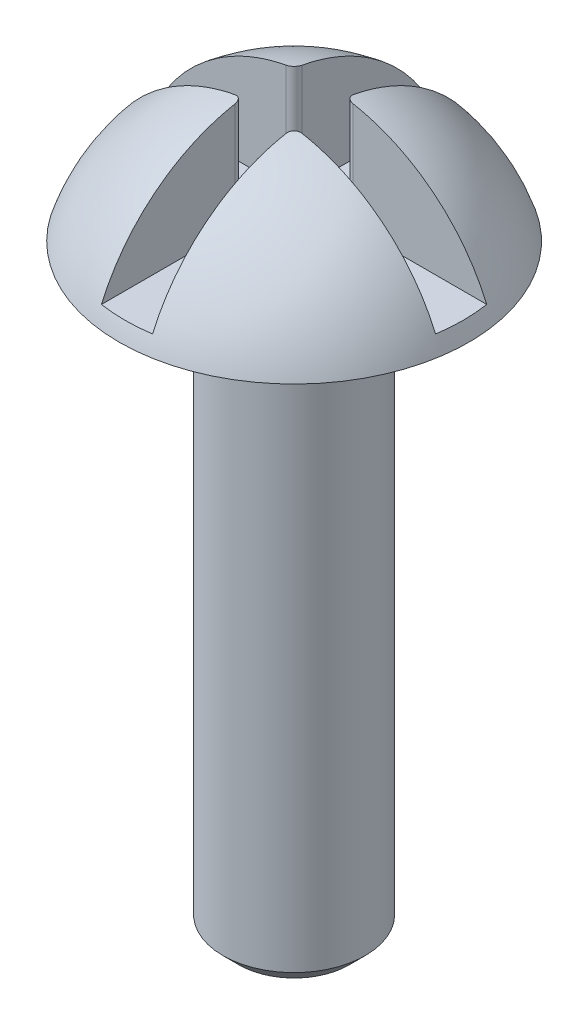
from build123d import *

# Parameters (mm, degrees)
SKETCH3_R           = 1.1303
BOSS_EXTRUDE1_DEPTH = 9.525
CHAMFER1_SIZE       = 0.254
CUT_EXTRUDE1_START  = 0.254
CUT_EXTRUDE1_DEPTH  = 11.051187256
FILLET1_R           = 0.127


with BuildPart() as part:
    # Sketch2 → Revolve1 (revolve)
    with BuildSketch(Plane(origin=(0, 0, 0), x_dir=(0, 0, -1), z_dir=(1, 0, 0))):
        with BuildLine():
            Line((0, 0), (2.7813, 0))
            ThreePointArc((2.7813, 0), (1.72225533, 1.469884796), (0, 2.032))
            Line((0, 2.032), (0, 0))
        make_face()
    revolve(axis=Axis((0, 0.415157056, 0), (0, -1, 0)))

    # Sketch3 → Boss-Extrude1 (add)
    with BuildSketch(Plane.XZ):
        with Locations(Location((0, 0, 0), (0, 0, 90))):
            Circle(SKETCH3_R)
    extrude(amount=BOSS_EXTRUDE1_DEPTH)

    # Chamfer1
    chamfer1_edges = [part.edges().sort_by_distance(p)[0] for p in [
        (0, -9.525, -1.1303),
    ]]
    chamfer(chamfer1_edges, length=CHAMFER1_SIZE)

    # Sketch4 → Cut-Extrude1 (cut, through all)
    with BuildSketch(Plane(origin=(0, 0, 0), x_dir=(1, 0, 0), z_dir=(0, 1, 0)).offset(CUT_EXTRUDE1_START)):
        Polygon((-0.4064, 0.4064), (-0.4064, 2.7813), (0.4064, 2.7813), (0.4064, 0.4064), (2.7813, 0.4064), (2.7813, -0.4064), (0.4064, -0.4064), (0.4064, -2.7813), (-0.4064, -2.7813), (-0.4064, -0.4064), (-2.7813, -0.4064), (-2.7813, 0.4064), align=None)
    extrude(amount=CUT_EXTRUDE1_DEPTH, mode=Mode.SUBTRACT)

    # Fillet1
    fillet1_edges = [part.edges().sort_by_distance(p)[0] for p in [
        (0.4064, 1.114434201, -0.4064),
        (-0.4064, 1.114434201, -0.4064),
        (-0.4064, 1.114434201, 0.4064),
        (0.4064, 1.114434201, 0.4064),
    ]]
    fillet(fillet1_edges, radius=FILLET1_R)


solid = part.part
